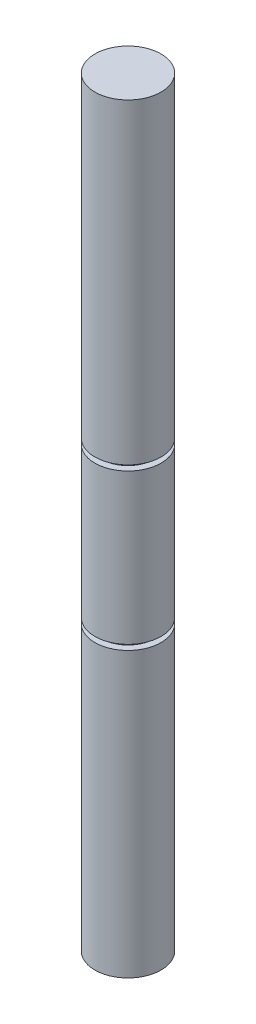
from build123d import *

# Parameters (mm, degrees)
SKETCH1_R           = 5
BOSS_EXTRUDE1_DEPTH = 115
SKETCH2_W           = 1
SKETCH2_H           = 0.8
LPATTERN1_COUNT     = 2
LPATTERN1_PITCH     = 23.5


with BuildPart() as part:
    # Sketch1 → Boss-Extrude1 (new body)
    with BuildSketch(Plane(origin=(0, 0, 0), x_dir=(1, 0, 0), z_dir=(0, 1, 0))):
        with Locations(Location((0, 0, 0), (0, 0, 270))):
            Circle(SKETCH1_R)
    extrude(amount=BOSS_EXTRUDE1_DEPTH)

    # Sketch2 → Cut-Revolve1 (revolve, cut)
    with BuildSketch(Plane(origin=(0, 0, 0), x_dir=(0, 0, -1), z_dir=(1, 0, 0)), mode=Mode.PRIVATE) as cut_revolve1_sk:
        with Locations((4.5, 66.8)):
            Rectangle(SKETCH2_W, SKETCH2_H)
    cut_revolve1 = revolve(cut_revolve1_sk.sketch.rotate(Axis((0, 115, 0), (0, -1, 0)), 180), axis=Axis((0, 115, 0), (0, -1, 0)), mode=Mode.SUBTRACT)

    # LPattern1: Cut-Revolve1 ×2
    with Locations(*[(0, -i * LPATTERN1_PITCH, 0) for i in range(1, LPATTERN1_COUNT)]):
        add(cut_revolve1, mode=Mode.SUBTRACT)


solid = part.part
